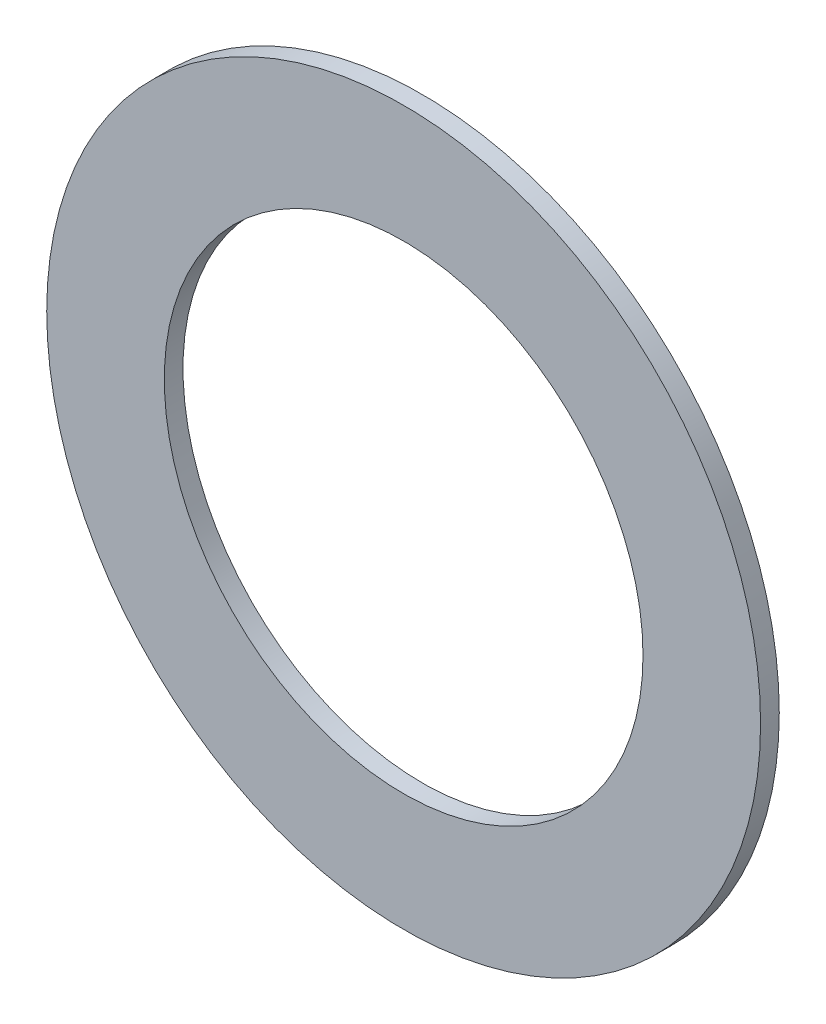
from build123d import *

# Parameters (mm, degrees)
SKETCH1_R           = 76.35
SKETCH1_R_2         = 51.2
BOSS_EXTRUDE1_DEPTH = 4


with BuildPart() as part:
    # Sketch1 → Boss-Extrude1 (new body)
    with BuildSketch(Plane.XY):
        Circle(SKETCH1_R)
        Circle(SKETCH1_R_2, mode=Mode.SUBTRACT)
    extrude(amount=BOSS_EXTRUDE1_DEPTH)


solid = part.part
